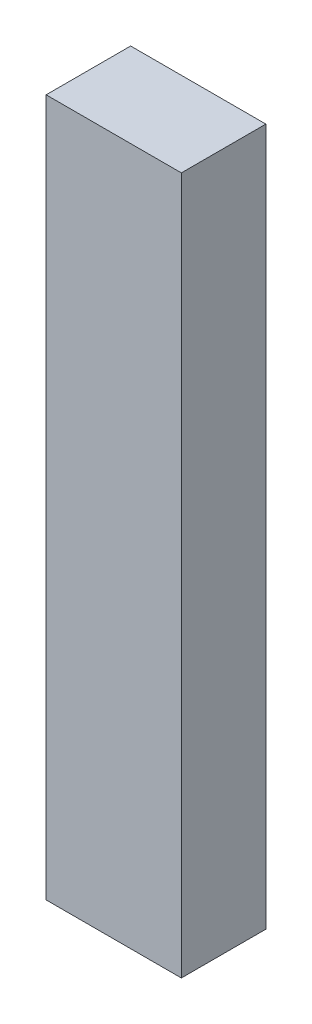
from build123d import *

# Parameters (mm, degrees)
SKETCH_1_W      = 320
SKETCH_1_H      = 1650
EXTRUDE_1_DEPTH = 200


with BuildPart() as part:
    # 草图1 → 凸台-拉伸1 (new body)
    with BuildSketch(Plane.XY):
        Rectangle(SKETCH_1_W, SKETCH_1_H)
    extrude(amount=EXTRUDE_1_DEPTH)


solid = part.part
